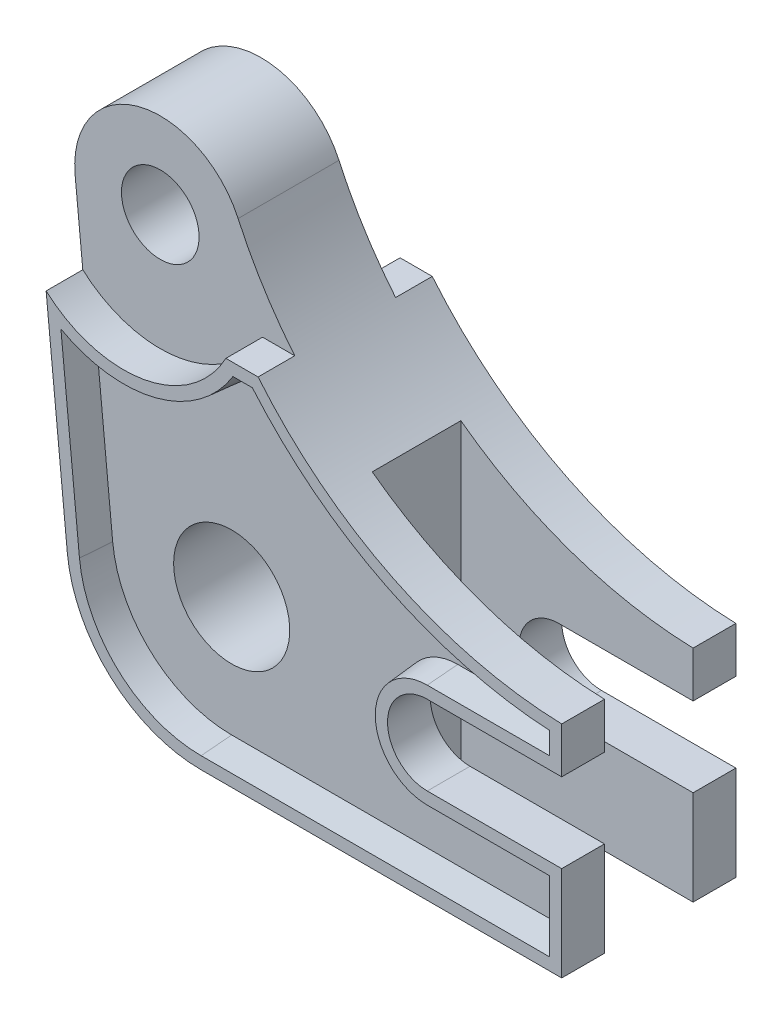
from build123d import *

# Parameters (mm, degrees)
ESQUISSE1_R                  = 9.5
ESQUISSE1_R_2                = 6.35
BOSS_EXTRU_1_DEPTH           = 14.25
ENL_V_MAT_EXTRU_1_DEPTH      = 6
ENL_V_MAT_EXTRU_2_DEPTH      = 7.25
ENL_V_MAT_EXTRU_2_DEPTH_BACK = 7.25
ENL_V_MAT_EXTRU_3_DEPTH      = 5
ENL_V_MAT_EXTRU_3_DRAFT      = -5


with BuildPart() as part:
    # Esquisse1 → Boss.-Extru.1 (new, symmetric)
    with BuildSketch(Plane.XY):
        with BuildLine():
            Line((-26.61523279, 45.963348263), (-21.894870769, -2.148169925))
            ThreePointArc((-21.894870769, -2.148169925), (-14.777351956, -16.298155392), (0, -22))
            Line((0, -22), (59, -22))
            Line((59, -22), (59, -6.5))
            Line((59, -6.5), (37, -6.5))
            ThreePointArc((37, -6.5), (30.5, 0), (37, 6.5))
            Line((37, 6.5), (59, 6.5))
            Line((59, 6.5), (59, 14))
            ThreePointArc((59, 14), (23.937620364, 25.155899787), (0.053417306, 53.144636986))
            ThreePointArc((0.053417306, 53.144636986), (-16.322360933, 60.848824799), (-26.61523279, 45.963348263))
        make_face()
        with Locations(Location((0, 0, 0), (0, 0, 180))):
            Circle(ESQUISSE1_R, mode=Mode.SUBTRACT)
        with Locations(Location((-12.68213321, 47.330365488, 0), (0, 0, 180))):
            Circle(ESQUISSE1_R_2, mode=Mode.SUBTRACT)
    extrude(amount=BOSS_EXTRU_1_DEPTH, both=True)

    # Esquisse2 → Enlèv. mat.-Extru.1 (cut)
    with BuildSketch(Plane.XY.offset(14.25)):
        with BuildLine():
            Line((4.051067321, 38.330365488), (9.321809703, 38.330365488))
            ThreePointArc((9.321809703, 38.330365488), (4.202566317, 45.434036591), (0.053417306, 53.144636986))
            ThreePointArc((0.053417306, 53.144636986), (-16.322360933, 60.848824799), (-26.61523279, 45.963348263))
            Line((-26.61523279, 45.963348263), (-25.360971776, 33.179497931))
            ThreePointArc((-25.360971776, 33.179497931), (-9.404585059, 28.615193084), (4.051067321, 38.330365488))
        make_face()
    enl_v_mat_extru_1 = extrude(amount=-ENL_V_MAT_EXTRU_1_DEPTH, mode=Mode.SUBTRACT)

    # Symétrie1: Enlèv. mat.-Extru.1 across plane
    add(enl_v_mat_extru_1.mirror(Plane.XY), mode=Mode.SUBTRACT)

    # Esquisse3 → Enlèv. mat.-Extru.2 (cut, two sides: drawn at the far end of the back side and taken through both)
    with BuildSketch(Plane.XY.offset(-ENL_V_MAT_EXTRU_2_DEPTH_BACK)):
        with BuildLine():
            Line((21, -22), (21, 27.222240802))
            ThreePointArc((21, 27.222240802), (38.984037644, 17.691299917), (59, 14))
            Line((59, 14), (59, -22))
            Line((59, -22), (21, -22))
        make_face()
    extrude(amount=ENL_V_MAT_EXTRU_2_DEPTH + ENL_V_MAT_EXTRU_2_DEPTH_BACK, mode=Mode.SUBTRACT)


with BuildPart() as enl_v_mat_extru_3_tool:
    # Esquisse4 → Enlèv. mat.-Extru.3 (with draft: the straight prism first)
    with BuildSketch(Plane.XY.offset(14.25)):
        with BuildLine():
            Line((8.387524958, 36.330365488), (5.20641061, 36.330365488))
            ThreePointArc((5.20641061, 36.330365488), (-7.394798321, 27.006879326), (-22.942022259, 29.007301424))
            Line((-22.942022259, 29.007301424), (-19.904427971, -1.95288175))
            ThreePointArc((-19.904427971, -1.95288175), (-13.433956323, -14.816504902), (0, -20))
            Line((0, -20), (57, -20))
            Line((57, -20), (57, -8.5))
            Line((57, -8.5), (37, -8.5))
            ThreePointArc((37, -8.5), (28.5, 0), (37, 8.5))
            Line((37, 8.5), (57, 8.5))
            Line((57, 8.5), (57, 12.086242091))
            ThreePointArc((57, 12.086242091), (30.207518708, 19.223076596), (8.387524958, 36.330365488))
        make_face()
    extrude(amount=-ENL_V_MAT_EXTRU_3_DEPTH)
    # Enlèv. mat.-Extru.3: the draft: its side faces are tilted about the plane it starts from
    enl_v_mat_extru_3_sides = [enl_v_mat_extru_3_tool.faces().sort_by_distance(p)[0] for p in [
        (6.796967784, 36.330365488, 11.75),
        (-7.394798321, 27.006879326, 11.75),
        (-21.423225115, 13.527209837, 11.75),
        (-13.433956323, -14.816504902, 11.75),
        (28.5, -20, 11.75),
        (57, -14.25, 11.75),
        (47, -8.5, 11.75),
        (28.5, 0, 11.75),
        (47, 8.5, 11.75),
        (57, 10.293121046, 11.75),
        (30.207518708, 19.223076596, 11.75),
    ]]
    draft(enl_v_mat_extru_3_sides, Plane.XY.offset(14.25), ENL_V_MAT_EXTRU_3_DRAFT)


with BuildPart() as part_1:
    add(part.part)

    # Enlèv. mat.-Extru.3: cut by enl_v_mat_extru_3_tool
    add(enl_v_mat_extru_3_tool.part, mode=Mode.SUBTRACT)


solid = part_1.part
